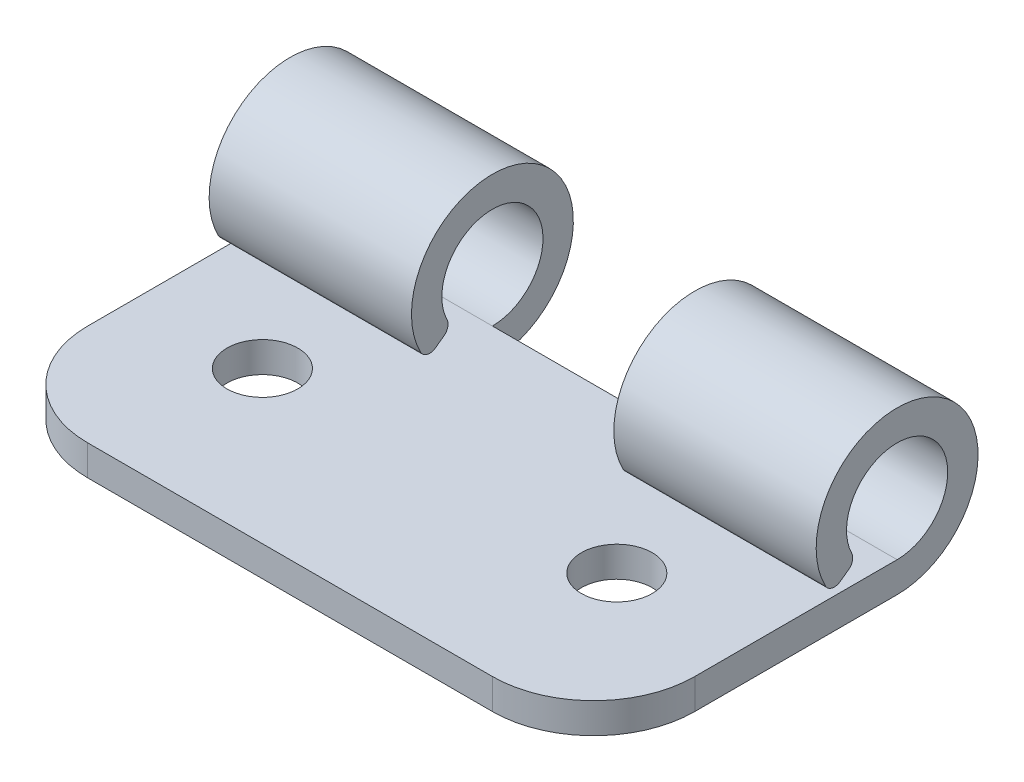
from build123d import *

# Parameters (mm, degrees)
SKETCH_1_W      = 30
SKETCH_1_H      = 15
SKETCH_1_R      = 1.75
EXTRUDE_1_DEPTH = 1.5
FILLET_1_R      = 5
EXTRUDE_2_DEPTH = 10


with BuildPart() as part:
    # 草图1 → 凸台-拉伸1 (new body)
    with BuildSketch(Plane(origin=(0, 0, 0), x_dir=(1, 0, 0), z_dir=(0, 1, 0))):
        Rectangle(SKETCH_1_W, SKETCH_1_H)
        with Locations(Location((-8.867330988, 0, 0), (0, 0, 270))):
            Circle(SKETCH_1_R, mode=Mode.SUBTRACT)
        with Locations(Location((8.647397187, 0, 0), (0, 0, 270))):
            Circle(SKETCH_1_R, mode=Mode.SUBTRACT)
    extrude(amount=EXTRUDE_1_DEPTH)

    # 圆角1
    fillet_1_edges = [part.edges().sort_by_distance(p)[0] for p in [
        (-15, 0.75, 7.5),
        (15, 0.75, 7.5),
    ]]
    fillet(fillet_1_edges, radius=FILLET_1_R)

    # 草图2 → 凸台-拉伸2 (add)
    with BuildSketch(Plane(origin=(15, 0, 0), x_dir=(0, 0, -1), z_dir=(1, 0, 0))):
        with BuildLine():
            Line((7.5, 1.5), (7.5, 0))
            ThreePointArc((7.5, 0), (9.573370103, 7.420692388), (3.953819335, 2.149431792))
            ThreePointArc((3.953819335, 2.149431792), (4.281764154, 1.894235083), (4.689365013, 1.975072601))
            Line((4.689365013, 1.975072601), (5.099963472, 2.270889054))
            ThreePointArc((5.099963472, 2.270889054), (5.292783095, 2.555387358), (5.256408648, 2.897141058))
            ThreePointArc((5.256408648, 2.897141058), (8.821524242, 6.1221625), (7.5, 1.5))
        make_face()
    extrude_2 = extrude(amount=-EXTRUDE_2_DEPTH)

    # 镜向1: 凸台-拉伸2 across plane
    add(extrude_2.mirror(Plane(origin=(0, 0, 0), x_dir=(0, 0, 1), z_dir=(1, 0, 0))))


solid = part.part
